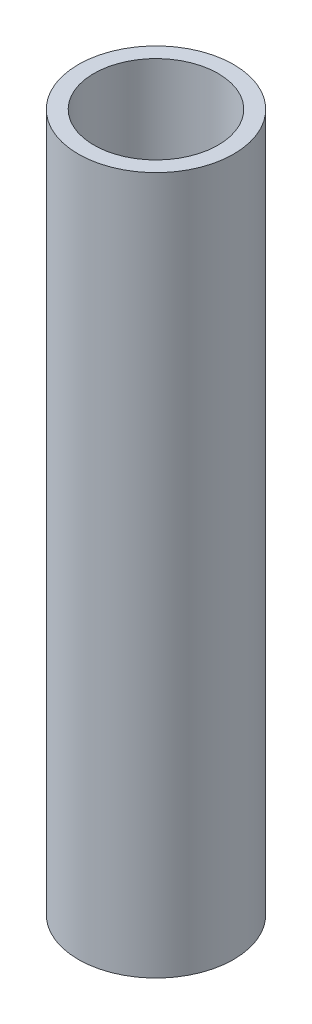
from build123d import *

# Parameters (mm, degrees)
SKETCH1_R           = 3.175
SKETCH1_R_2         = 2.54
BOSS_EXTRUDE1_DEPTH = 28.5242


with BuildPart() as part:
    # Sketch1 → Boss-Extrude1 (new body)
    with BuildSketch(Plane(origin=(0, 0, 0), x_dir=(1, 0, 0), z_dir=(0, 1, 0))):
        Circle(SKETCH1_R)
        Circle(SKETCH1_R_2, mode=Mode.SUBTRACT)
    extrude(amount=BOSS_EXTRUDE1_DEPTH)


solid = part.part
